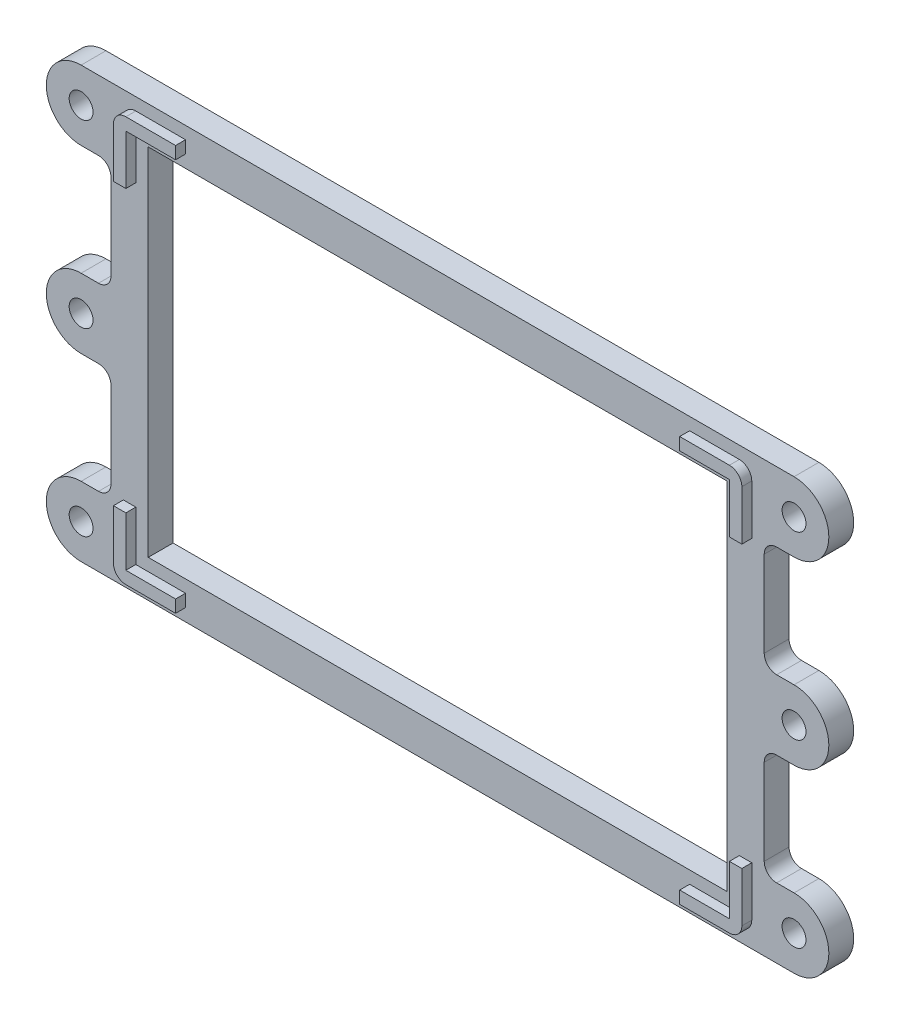
from build123d import *

# Parameters (mm, degrees)
BOSS_EXTRUDE3_DEPTH   = 2
BOSS_EXTRUDE3_2_DEPTH = 2
BOSS_EXTRUDE3_3_DEPTH = 2
BOSS_EXTRUDE3_4_DEPTH = 2
SKETCH2_W             = 131.4
SKETCH2_H             = 86.5
SKETCH2_W_2           = 116.4
SKETCH2_H_2           = 71.5
SKETCH2_R             = 2.4
BOSS_EXTRUDE4_DEPTH   = 5
FILLET1_R             = 2.5


with BuildPart() as part:
    # Sketch1 → Boss-Extrude3 (new body)
    with BuildSketch(Plane.XY):
        with BuildLine():
            ThreePointArc((63.2, -38.25), (62.467766953, -40.017766953), (60.7, -40.75))
            Line((60.7, -40.75), (50.7, -40.75))
            Line((50.7, -40.75), (50.7, -38.25))
            Line((50.7, -38.25), (60.7, -38.25))
            Line((60.7, -38.25), (60.7, -28.25))
            Line((60.7, -28.25), (63.2, -28.25))
            Line((63.2, -28.25), (63.2, -38.25))
        make_face()
    extrude(amount=-BOSS_EXTRUDE3_DEPTH)



with BuildPart() as body_2:
    # Sketch1 → Boss-Extrude3 2 (new body)
    with BuildSketch(Plane.XY):
        with BuildLine():
            Line((63.2, 28.25), (63.2, 38.25))
            ThreePointArc((63.2, 38.25), (62.467766953, 40.017766953), (60.7, 40.75))
            Line((60.7, 40.75), (50.7, 40.75))
            Line((50.7, 40.75), (50.7, 38.25))
            Line((50.7, 38.25), (60.7, 38.25))
            Line((60.7, 38.25), (60.7, 28.25))
            Line((60.7, 28.25), (63.2, 28.25))
        make_face()
    extrude(amount=-BOSS_EXTRUDE3_2_DEPTH)


with BuildPart() as body_3:
    # Sketch1 → Boss-Extrude3 3 (new body)
    with BuildSketch(Plane.XY):
        with BuildLine():
            ThreePointArc((-63.2, 38.25), (-62.467766953, 40.017766953), (-60.7, 40.75))
            Line((-60.7, 40.75), (-50.7, 40.75))
            Line((-50.7, 40.75), (-50.7, 38.25))
            Line((-50.7, 38.25), (-60.7, 38.25))
            Line((-60.7, 38.25), (-60.7, 28.25))
            Line((-60.7, 28.25), (-63.2, 28.25))
            Line((-63.2, 28.25), (-63.2, 38.25))
        make_face()
    extrude(amount=-BOSS_EXTRUDE3_3_DEPTH)


with BuildPart() as body_4:
    # Sketch1 → Boss-Extrude3 4 (new body)
    with BuildSketch(Plane.XY):
        with BuildLine():
            Line((-63.2, -28.25), (-63.2, -38.25))
            ThreePointArc((-63.2, -38.25), (-62.467766953, -40.017766953), (-60.7, -40.75))
            Line((-60.7, -40.75), (-50.7, -40.75))
            Line((-50.7, -40.75), (-50.7, -38.25))
            Line((-50.7, -38.25), (-60.7, -38.25))
            Line((-60.7, -38.25), (-60.7, -28.25))
            Line((-60.7, -28.25), (-63.2, -28.25))
        make_face()
    extrude(amount=-BOSS_EXTRUDE3_4_DEPTH)


with BuildPart() as part_1:
    add(part.part)

    add(body_3.part)  # Boss-Extrude4 merges body 3

    add(body_4.part)  # Boss-Extrude4 merges body 4
    # Sketch2 → Boss-Extrude4 (add)
    # profile 1 of 8: a face of its own
    with BuildSketch(Plane(origin=(0, 0, -2), x_dir=(-1, 0, 0), z_dir=(0, 0, -1))):
        Rectangle(SKETCH2_W, SKETCH2_H)
        Rectangle(SKETCH2_W_2, SKETCH2_H_2, mode=Mode.SUBTRACT)
        with BuildLine():
            Line((-63.2, 38.25), (-63.2, 28.25))
            Line((-63.2, 28.25), (-60.7, 28.25))
            Line((-60.7, 28.25), (-60.7, 38.25))
            Line((-60.7, 38.25), (-50.7, 38.25))
            Line((-50.7, 38.25), (-50.7, 40.75))
            Line((-50.7, 40.75), (-60.7, 40.75))
            ThreePointArc((-60.7, 40.75), (-62.467766953, 40.017766953), (-63.2, 38.25))
        make_face(mode=Mode.SUBTRACT)
    # profile 2 of 8: a face of its own
    with BuildSketch(Plane(origin=(0, 0, -2), x_dir=(-1, 0, 0), z_dir=(0, 0, -1))):
        with BuildLine():
            Line((-65.7, 29.25), (-65.7, 43.25))
            Line((-65.7, 43.25), (-71.7, 43.25))
            ThreePointArc((-71.7, 43.25), (-78.7, 36.25), (-71.7, 29.25))
            Line((-71.7, 29.25), (-65.7, 29.25))
        make_face()
        with Locations((-71.7, 36.25)):
            Circle(SKETCH2_R, mode=Mode.SUBTRACT)
    # profile 3 of 8: a face of its own
    with BuildSketch(Plane(origin=(0, 0, -2), x_dir=(-1, 0, 0), z_dir=(0, 0, -1))):
        with BuildLine():
            Line((-65.7, -7), (-65.7, 7))
            Line((-65.7, 7), (-71.7, 7))
            ThreePointArc((-71.7, 7), (-78.7, 0), (-71.7, -7))
            Line((-71.7, -7), (-65.7, -7))
        make_face()
        with Locations((-71.7, 0)):
            Circle(SKETCH2_R, mode=Mode.SUBTRACT)
    # profile 4 of 8: a face of its own
    with BuildSketch(Plane(origin=(0, 0, -2), x_dir=(-1, 0, 0), z_dir=(0, 0, -1))):
        with BuildLine():
            Line((-65.7, -43.25), (-65.7, -29.25))
            Line((-65.7, -29.25), (-71.7, -29.25))
            ThreePointArc((-71.7, -29.25), (-78.7, -36.25), (-71.7, -43.25))
            Line((-71.7, -43.25), (-65.7, -43.25))
        make_face()
        with Locations((-71.7, -36.25)):
            Circle(SKETCH2_R, mode=Mode.SUBTRACT)
    # profile 5 of 8: a face of its own
    with BuildSketch(Plane(origin=(0, 0, -2), x_dir=(-1, 0, 0), z_dir=(0, 0, -1))):
        with BuildLine():
            Line((71.7, 43.25), (65.7, 43.25))
            Line((65.7, 43.25), (65.7, 29.25))
            Line((65.7, 29.25), (71.7, 29.25))
            ThreePointArc((71.7, 29.25), (78.7, 36.25), (71.7, 43.25))
        make_face()
        with Locations((71.7, 36.25)):
            Circle(SKETCH2_R, mode=Mode.SUBTRACT)
    # profile 6 of 8: a face of its own
    with BuildSketch(Plane(origin=(0, 0, -2), x_dir=(-1, 0, 0), z_dir=(0, 0, -1))):
        with BuildLine():
            Line((71.7, 7), (65.7, 7))
            Line((65.7, 7), (65.7, -7))
            Line((65.7, -7), (71.7, -7))
            ThreePointArc((71.7, -7), (78.7, 0), (71.7, 7))
        make_face()
        with Locations((71.7, 0)):
            Circle(SKETCH2_R, mode=Mode.SUBTRACT)
    # profile 7 of 8: a face of its own
    with BuildSketch(Plane(origin=(0, 0, -2), x_dir=(-1, 0, 0), z_dir=(0, 0, -1))):
        with BuildLine():
            Line((71.7, -29.25), (65.7, -29.25))
            Line((65.7, -29.25), (65.7, -43.25))
            Line((65.7, -43.25), (71.7, -43.25))
            ThreePointArc((71.7, -43.25), (78.7, -36.25), (71.7, -29.25))
        make_face()
        with Locations((71.7, -36.25)):
            Circle(SKETCH2_R, mode=Mode.SUBTRACT)
    # profile 8 of 8: a face of its own
    with BuildSketch(Plane(origin=(0, 0, -2), x_dir=(-1, 0, 0), z_dir=(0, 0, -1))):
        with BuildLine():
            ThreePointArc((-60.7, 40.75), (-62.467766953, 40.017766953), (-63.2, 38.25))
            Line((-63.2, 38.25), (-63.2, 28.25))
            Line((-63.2, 28.25), (-60.7, 28.25))
            Line((-60.7, 28.25), (-60.7, 38.25))
            Line((-60.7, 38.25), (-50.7, 38.25))
            Line((-50.7, 38.25), (-50.7, 40.75))
            Line((-50.7, 40.75), (-60.7, 40.75))
        make_face()
    extrude(amount=BOSS_EXTRUDE4_DEPTH)

    # Fillet1
    fillet1_edges = [part_1.edges().sort_by_distance(p)[0] for p in [
        (-65.7, 7, -4.5),
        (-65.7, 29.25, -4.5),
        (65.7, 29.25, -4.5),
        (65.7, 7, -4.5),
        (65.7, -7, -4.5),
        (65.7, -29.25, -4.5),
        (-65.7, -29.25, -4.5),
        (-65.7, -7, -4.5),
    ]]
    fillet(fillet1_edges, radius=FILLET1_R)


solid = Compound([body_2.part, part_1.part])
